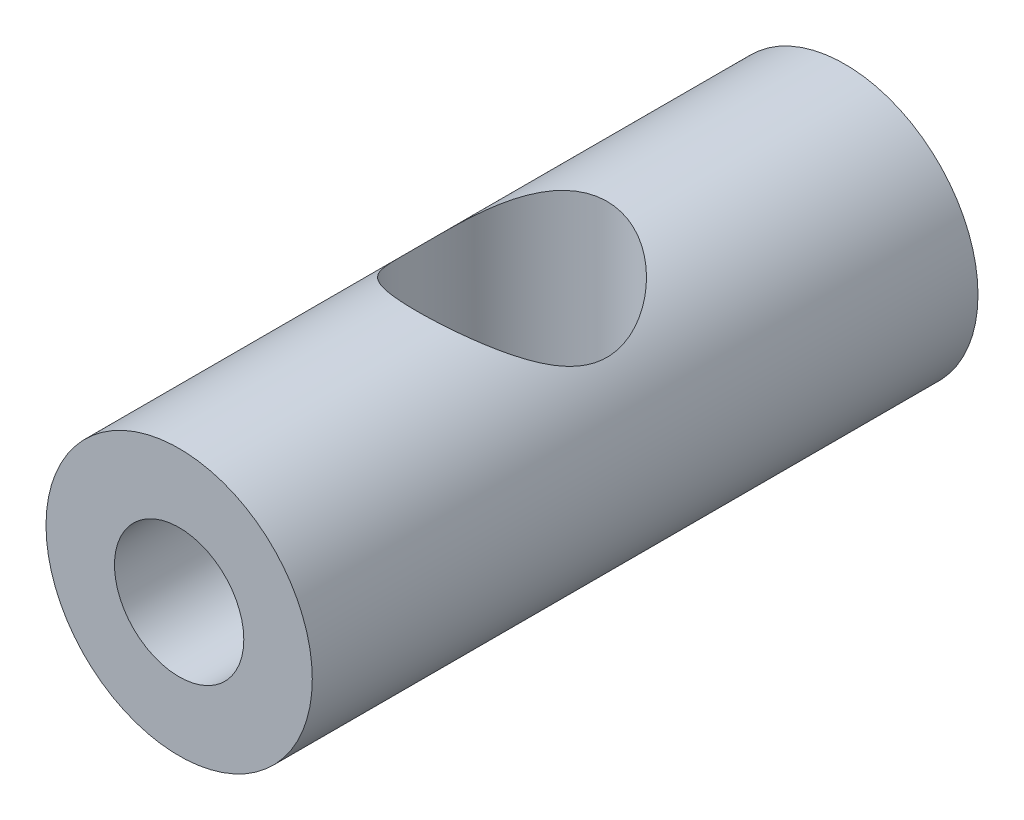
from build123d import *

# Parameters (mm, degrees)
ESQUISSE1_R                  = 7
BOSS_EXTRU_1_DEPTH           = 17.5
ENL_V_MAT_EXTRU_1_DEPTH      = 21.105969263
ENL_V_MAT_EXTRU_1_DEPTH_BACK = 21.105969263
ESQUISSE2_R                  = 5
TROU_TARAUD_M81_D            = 6.8
TROU_TARAUD_M81_DEPTH        = 20
TROU_TARAUD_M81_TIP          = 2.042926105


with BuildPart() as part:
    # Esquisse1 → Boss.-Extru.1 (new, symmetric)
    with BuildSketch(Plane.XY):
        Circle(ESQUISSE1_R)
    extrude(amount=BOSS_EXTRU_1_DEPTH, both=True)

    # Esquisse2 → Enlèv. mat.-Extru.1 (cut, two sides: drawn at the far end of the back side and taken through both)
    with BuildSketch(Plane(origin=(0, 0, 0), x_dir=(1, 0, 0), z_dir=(0, 1, 0)).offset(-ENL_V_MAT_EXTRU_1_DEPTH_BACK)):
        with Locations(Location((0, 0, 0), (0, 0, 270))):
            Circle(ESQUISSE2_R)
    extrude(amount=ENL_V_MAT_EXTRU_1_DEPTH + ENL_V_MAT_EXTRU_1_DEPTH_BACK, mode=Mode.SUBTRACT)

    # Trou taraudé M81
    with Locations(Plane.XY.offset(17.5)):
        with Locations((0, 0)):
            Hole(TROU_TARAUD_M81_D / 2, depth=TROU_TARAUD_M81_DEPTH)
            with Locations((0, 0, -(TROU_TARAUD_M81_DEPTH + TROU_TARAUD_M81_TIP / 2))):  # 118° drill point
                Cone(0, TROU_TARAUD_M81_D / 2, TROU_TARAUD_M81_TIP, mode=Mode.SUBTRACT)


solid = part.part
